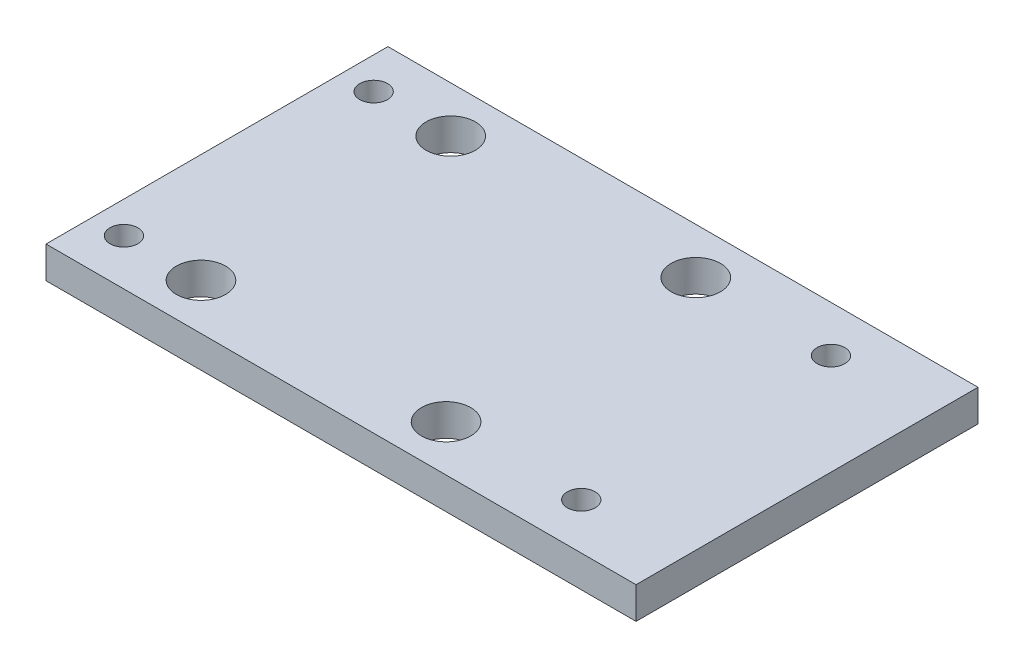
from build123d import *

# Parameters (mm, degrees)
SKETCH1_W           = 74.2
SKETCH1_H           = 46
BOSS_EXTRUDE1_DEPTH = 43
SKETCH2_R           = 11.5
SKETCH2_R_2         = 1.75
SKETCH2_R_3         = 2.5
CUT_EXTRUDE1_DEPTH  = 20
SKETCH3_R           = 3.1
SKETCH3_R_2         = 1.75
CUT_EXTRUDE2_DEPTH  = 15
CUT_EXTRUDE3_DEPTH  = 2.4
SKETCH5_R           = 2.75
CUT_EXTRUDE4_DEPTH  = 12.4


with BuildPart() as part:
    # Sketch1 → Boss-Extrude1 (new body)
    with BuildSketch(Plane.XY):
        with Locations((-13.1, 10)):
            Rectangle(SKETCH1_W, SKETCH1_H)
        Polygon((0, 0), (20, 0), (20, 20), (0, 20), (0, 29), (-42.2, 29), (-42.2, -9), (0, -9), align=None, mode=Mode.SUBTRACT)
    extrude(amount=BOSS_EXTRUDE1_DEPTH)

    # Sketch2 → Cut-Extrude1 (cut)
    with BuildSketch(Plane.XZ.offset(13)):
        with Locations((-21.1, 21.5)):
            Circle(SKETCH2_R)
        with Locations((-36.509600894, 37.201726029)):
            Circle(SKETCH2_R_2)
        with Locations((-5.690399106, 5.798273971)):
            Circle(SKETCH2_R_2)
        with Locations((-36.509600894, 5.798273971)):
            Circle(SKETCH2_R_2)
        with Locations((-5.690399106, 37.201726029)):
            Circle(SKETCH2_R_2)
        with Locations((10, 37.201726029)):
            Circle(SKETCH2_R_3)
        with Locations((10, 5.798273971)):
            Circle(SKETCH2_R_3)
    extrude(amount=-CUT_EXTRUDE1_DEPTH, mode=Mode.SUBTRACT)

    # Sketch3 → Cut-Extrude2 (cut)
    with BuildSketch(Plane(origin=(0, 33, 0), x_dir=(1, 0, 0), z_dir=(0, 1, 0))):
        with Locations(Location((-36.509600894, -5.798273971, 0), (0, 0, 270))):
            Circle(SKETCH3_R)
        with Locations(Location((-5.690399106, -5.798273971, 0), (0, 0, 270))):
            Circle(SKETCH3_R)
        with Locations(Location((-5.690399106, -37.201726029, 0), (0, 0, 270))):
            Circle(SKETCH3_R)
        with Locations(Location((-36.509600894, -37.201726029, 0), (0, 0, 270))):
            Circle(SKETCH3_R)
        with Locations(Location((-46.2, -5.798273971, 0), (0, 0, 270))):
            Circle(SKETCH3_R_2)
        with Locations(Location((-46.2, -37.201726029, 0), (0, 0, 270))):
            Circle(SKETCH3_R_2)
        with Locations(Location((11.309600894, -5.798273971, 0), (0, 0, 270))):
            Circle(SKETCH3_R_2)
        with Locations(Location((11.309600894, -37.201726029, 0), (0, 0, 270))):
            Circle(SKETCH3_R_2)
    extrude(amount=-CUT_EXTRUDE2_DEPTH, mode=Mode.SUBTRACT)


with BuildPart() as body_2:
    # Split1: the piece on the far side of the plane
    add(part.part)
    split(bisect_by=Plane.ZX.offset(29), keep=Keep.BOTTOM)

    # Sketch4 → Cut-Extrude3 (cut)
    with BuildSketch(Plane(origin=(0, 29, 0), x_dir=(1, 0, 0), z_dir=(0, 1, 0))):
        Polygon((-46.2, -2.334172356), (-49.2, -4.066223163), (-49.2, -7.530324778), (-46.2, -9.262375586), (-43.2, -7.530324778), (-43.2, -4.066223163), align=None)
        Polygon((-43.2, -35.469675222), (-46.2, -33.737624414), (-49.2, -35.469675222), (-49.2, -38.933776837), (-46.2, -40.665827644), (-43.2, -38.933776837), align=None)
        Polygon((14.309600894, -4.066223163), (11.309600894, -2.334172356), (8.309600894, -4.066223163), (8.309600894, -7.530324778), (11.309600894, -9.262375586), (14.309600894, -7.530324778), align=None)
        Polygon((14.309600894, -35.469675222), (11.309600894, -33.737624414), (8.309600894, -35.469675222), (8.309600894, -38.933776837), (11.309600894, -40.665827644), (14.309600894, -38.933776837), align=None)
    extrude(amount=-CUT_EXTRUDE3_DEPTH, mode=Mode.SUBTRACT)

    # Sketch5 → Cut-Extrude4 (cut)
    with BuildSketch(Plane(origin=(24, 0, 0), x_dir=(0, 0, -1), z_dir=(1, 0, 0))):
        with Locations(Location((-35.5, 10, 0), (0, 0, 90))):
            Circle(SKETCH5_R)
        with Locations(Location((-7.5, 10, 0), (0, 0, 90))):
            Circle(SKETCH5_R)
    extrude(amount=-CUT_EXTRUDE4_DEPTH, mode=Mode.SUBTRACT)


with BuildPart() as part_1:
    add(part.part)

    # Split1
    split(bisect_by=Plane.ZX.offset(29), keep=Keep.TOP)


solid = part_1.part
